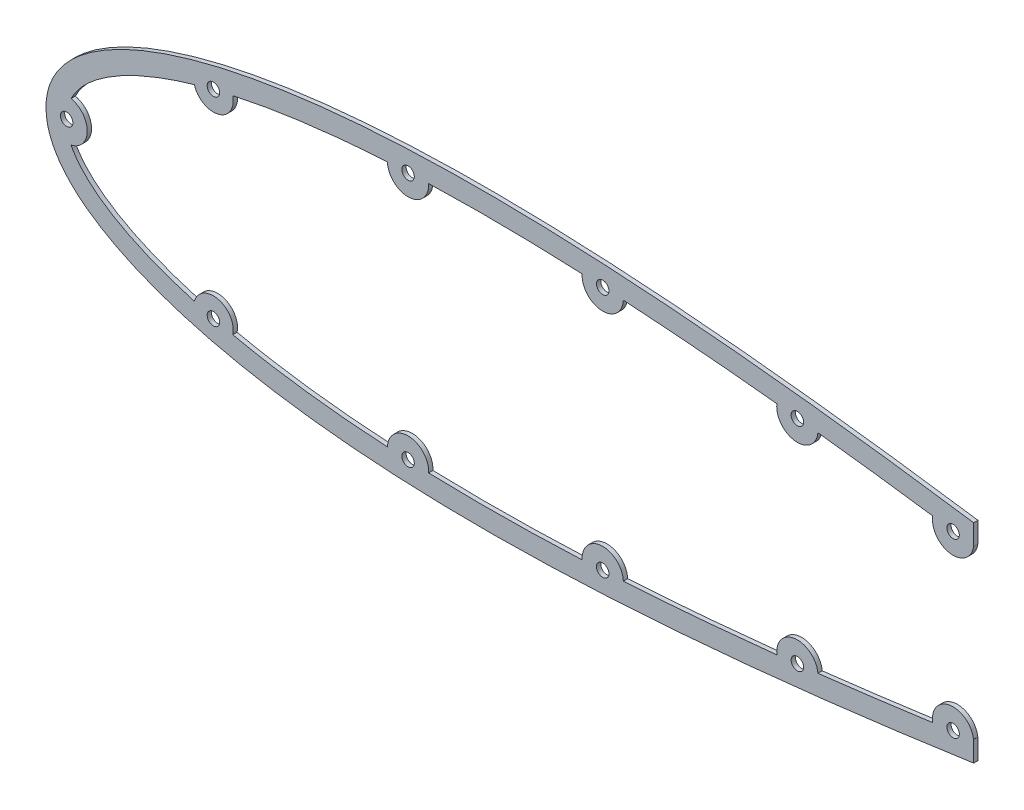
from build123d import *

# Parameters (mm, degrees)
BOSS_EXTRUDE1_DEPTH      = 0.5
BOSS_EXTRUDE1_DEPTH_BACK = 0.6
SKETCH2_R                = 1.6


with BuildPart() as part:
    # Sketch2 → Boss-Extrude1 (new, two sides: drawn at the far end of the back side and taken through both)
    with BuildSketch(Plane.XY.offset(-BOSS_EXTRUDE1_DEPTH_BACK)):
        with BuildLine():
            Line((68.201357245, -26.733949273), (68.201357245, -21.47833931))
            Line((68.201357245, -21.47833931), (68.159894479, -21.484425998))
            ThreePointArc((68.159894479, -21.484425998), (62.15016472, -16.899585112), (57.668428958, -22.986592774))
            add(Edge.make_bspline(
                [(57.668428958, -22.986592774), (47.853043444, -24.355170303), (38.022617831, -25.621799852), (28.177984355, -26.761093033)],
                knots=[0.059474899, 0.059474899, 0.059474899, 0.059474899, 0.173129016, 0.173129016, 0.173129016, 0.173129016], degree=3))
            ThreePointArc((28.177984355, -26.761093033), (22.31733743, -21.990567086), (17.643963915, -27.928974294))
            add(Edge.make_bspline(
                [(17.643963915, -27.928974294), (11.078628537, -28.624082245), (-2.07316099, -29.892088868), (-15.219948256, -30.860683929), (-21.802354618, -31.256314848)],
                knots=[0.213671694, 0.213671694, 0.213671694, 0.213671694, 0.289490145, 0.365308597, 0.365308597, 0.365308597, 0.365308597], degree=3))
            ThreePointArc((-21.802354618, -31.256314848), (-27.376757004, -26.161939726), (-32.386548654, -31.812480184))
            add(Edge.make_bspline(
                [(-32.386548654, -31.812480184), (-38.959063535, -32.106086463), (-52.129021906, -32.492359058), (-65.246399747, -32.389884675), (-71.807207713, -32.182843085)],
                knots=[0.405969309, 0.405969309, 0.405969309, 0.405969309, 0.481795373, 0.557621436, 0.557621436, 0.557621436, 0.557621436], degree=3))
            ThreePointArc((-71.807207713, -32.182843085), (-76.860543966, -26.587004362), (-82.395753671, -31.706679335))
            add(Edge.make_bspline(
                [(-82.395753671, -31.706679335), (-89.087892098, -31.312216423), (-99.140003614, -30.45099657), (-112.350669892, -28.542867343), (-118.868072113, -27.300885184), (-122.112163065, -26.591242701)],
                knots=[0.598525169, 0.598525169, 0.598525169, 0.598525169, 0.676378843, 0.71530568, 0.754232517, 0.754232517, 0.754232517, 0.754232517], degree=3))
            ThreePointArc((-122.112163065, -26.591242701), (-125.853679665, -20.579975606), (-131.995592602, -24.102926647))
            add(Edge.make_bspline(
                [(-131.995592602, -24.102926647), (-133.611979112, -23.636690133), (-136.836035695, -22.642564712), (-143.130231184, -20.39941201), (-149.168194106, -17.714720355), (-154.680031551, -14.453685135), (-157.804221697, -12.146079416), (-159.99854138, -10.130661783), (-161.461859738, -8.539212982), (-162.712476821, -6.873435276), (-163.362450026, -5.761281043), (-163.65227306, -5.174236453)],
                knots=[0.794325873, 0.794325873, 0.794325873, 0.794325873, 0.81432721, 0.834328546, 0.87433122, 0.894332557, 0.914333894, 0.924334563, 0.934335231, 0.9443359, 0.954336568, 0.954336568, 0.954336568, 0.954336568], degree=3))
            ThreePointArc((-163.65227306, -5.174236453), (-159.5, 0), (-163.65227306, 5.174236453))
            add(Edge.make_bspline(
                [(-163.65227306, 5.174236453), (-163.362450026, 5.761281043), (-162.712476821, 6.873435276), (-161.461859738, 8.539212982), (-159.99854138, 10.130661783), (-157.804221697, 12.146079416), (-154.680031551, 14.453685135), (-149.168194106, 17.714720355), (-143.130231184, 20.39941201), (-136.836035695, 22.642564712), (-133.611979112, 23.636690133), (-131.995592602, 24.102926647)],
                knots=[0.029339196, 0.029339196, 0.029339196, 0.029339196, 0.039339864, 0.049340533, 0.059341201, 0.06934187, 0.089343207, 0.109344544, 0.149347218, 0.169348555, 0.189349892, 0.189349892, 0.189349892, 0.189349892], degree=3))
            ThreePointArc((-131.995592602, 24.102926647), (-125.853679665, 20.579975606), (-122.112163065, 26.591242701))
            add(Edge.make_bspline(
                [(-122.112163065, 26.591242701), (-118.868072113, 27.300885184), (-112.350669892, 28.542867343), (-99.140003614, 30.45099657), (-89.087892098, 31.312216423), (-82.395753671, 31.706679335)],
                knots=[0.229443247, 0.229443247, 0.229443247, 0.229443247, 0.268370084, 0.307296921, 0.385150595, 0.385150595, 0.385150595, 0.385150595], degree=3))
            ThreePointArc((-82.395753671, 31.706679335), (-76.860543966, 26.587004362), (-71.807207713, 32.182843085))
            add(Edge.make_bspline(
                [(-71.807207713, 32.182843085), (-65.246399747, 32.389884675), (-52.129021906, 32.492359058), (-38.959063535, 32.106086463), (-32.386548654, 31.812480184)],
                knots=[0.426054328, 0.426054328, 0.426054328, 0.426054328, 0.501880391, 0.577706455, 0.577706455, 0.577706455, 0.577706455], degree=3))
            ThreePointArc((-32.386548654, 31.812480184), (-27.376757004, 26.161939726), (-21.802354618, 31.256314848))
            add(Edge.make_bspline(
                [(-21.802354618, 31.256314848), (-15.219948256, 30.860683929), (-2.07316099, 29.892088868), (11.078628537, 28.624082245), (17.643963915, 27.928974294)],
                knots=[0.618367167, 0.618367167, 0.618367167, 0.618367167, 0.694185619, 0.77000407, 0.77000407, 0.77000407, 0.77000407], degree=3))
            ThreePointArc((17.643963915, 27.928974294), (22.31733743, 21.990567086), (28.177984355, 26.761093033))
            add(Edge.make_bspline(
                [(28.177984355, 26.761093033), (38.022617831, 25.621799852), (47.853043444, 24.355170303), (57.668428958, 22.986592774)],
                knots=[0.810546748, 0.810546748, 0.810546748, 0.810546748, 0.924200865, 0.924200865, 0.924200865, 0.924200865], degree=3))
            ThreePointArc((57.668428958, 22.986592774), (62.15016472, 16.899585112), (68.159894479, 21.484425998))
            Line((68.159894479, 21.484425998), (68.201357245, 21.47833931))
            Line((68.201357245, 21.47833931), (68.201357245, 26.733949273))
            add(Edge.make_bspline(
                [(68.201357245, 26.733949273), (57.784215293, 28.258709207), (36.91636144, 31.091199089), (5.519942378, 34.537130133), (-25.974344285, 36.93772808), (-52.286796003, 37.764913232), (-73.340464706, 37.435601761), (-89.110901654, 36.585815405), (-104.8269913, 34.997231417), (-120.424524002, 32.474434182), (-133.225613254, 29.346860436), (-143.204672645, 25.95918533), (-150.479166338, 22.858389104), (-157.407409466, 19.022648577), (-163.707752392, 14.189151794), (-167.876889302, 8.951310427), (-169.777602037, 3.972256807), (-170.1, 1.320251829), (-170.1, 0)],
                knots=[0.358929883, 0.358929883, 0.358929883, 0.358929883, 0.439063648, 0.519197413, 0.599331177, 0.679464942, 0.719531824, 0.759598706, 0.799665589, 0.839732471, 0.879799353, 0.899832794, 0.919866235, 0.939899677, 0.959933118, 0.979966559, 0.989983279, 1, 1, 1, 1], degree=3))
            add(Edge.make_bspline(
                [(-170.1, 0), (-170.1, -1.320251828), (-169.777602037, -3.972256807), (-167.876889302, -8.951310426), (-163.707752392, -14.189151794), (-157.407409466, -19.022648577), (-150.479166338, -22.858389104), (-143.204672645, -25.95918533), (-133.225613254, -29.346860436), (-120.424524002, -32.474434182), (-104.8269913, -34.997231416), (-89.110901654, -36.585815405), (-73.340464706, -37.435601761), (-52.286796003, -37.764913232), (-25.974344285, -36.93772808), (5.519942378, -34.537130133), (36.91636144, -31.091199089), (57.784215293, -28.258709207), (68.201357245, -26.733949273)],
                knots=[0.359149159, 0.359149159, 0.359149159, 0.359149159, 0.36916588, 0.3791826, 0.399216041, 0.419249482, 0.439282924, 0.459316365, 0.479349806, 0.519416688, 0.55948357, 0.599550453, 0.639617335, 0.679684217, 0.759817982, 0.839951746, 0.920085511, 1.000219276, 1.000219276, 1.000219276, 1.000219276], degree=3))
        make_face()
        with Locations((62.901357245, 22.146080113)):
            Circle(SKETCH2_R, mode=Mode.SUBTRACT)
        with Locations((22.901357245, 27.258291533)):
            Circle(SKETCH2_R, mode=Mode.SUBTRACT)
        with Locations((-27.098642755, 31.454637758)):
            Circle(SKETCH2_R, mode=Mode.SUBTRACT)
        with Locations((-77.098642755, 31.88165345)):
            Circle(SKETCH2_R, mode=Mode.SUBTRACT)
        with Locations((-127.098642755, 25.52488803)):
            Circle(SKETCH2_R, mode=Mode.SUBTRACT)
        with Locations((-164.8, 0)):
            Circle(SKETCH2_R, mode=Mode.SUBTRACT)
        with Locations((-77.098642755, -31.88165345)):
            Circle(SKETCH2_R, mode=Mode.SUBTRACT)
        with Locations((-27.098642755, -31.454637758)):
            Circle(SKETCH2_R, mode=Mode.SUBTRACT)
        with Locations((22.901357245, -27.258291533)):
            Circle(SKETCH2_R, mode=Mode.SUBTRACT)
        with Locations((62.901357245, -22.146080113)):
            Circle(SKETCH2_R, mode=Mode.SUBTRACT)
        with Locations((-127.098642755, -25.52488803)):
            Circle(SKETCH2_R, mode=Mode.SUBTRACT)
    extrude(amount=BOSS_EXTRUDE1_DEPTH + BOSS_EXTRUDE1_DEPTH_BACK)


solid = part.part
